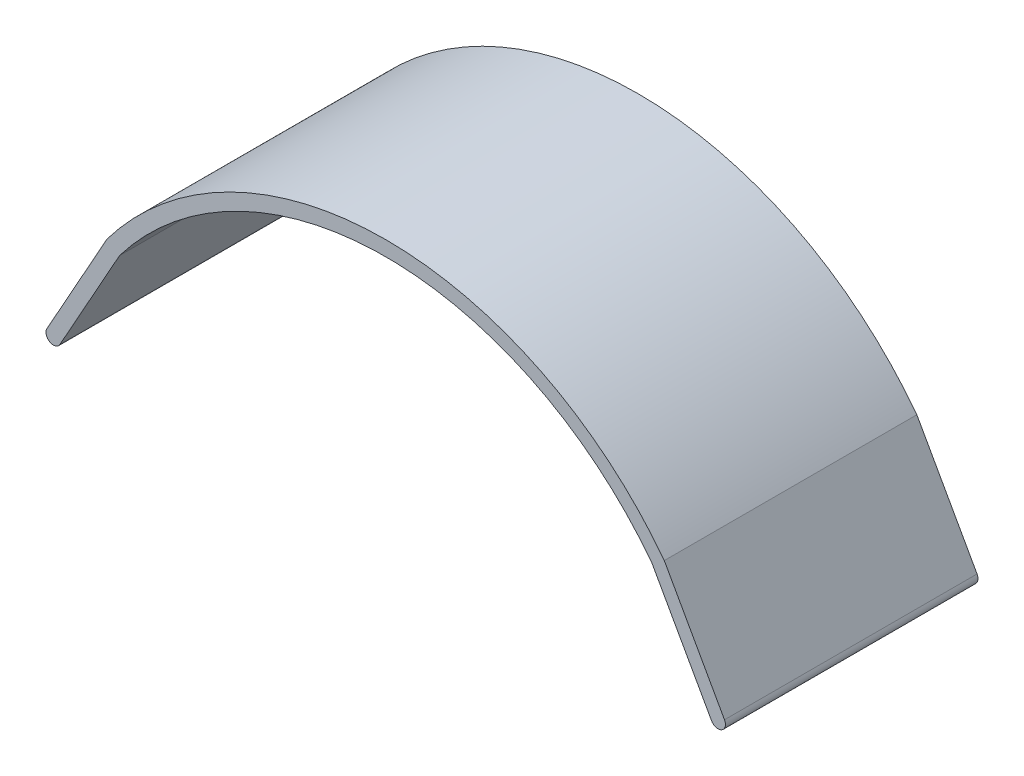
from build123d import *

# Parameters (mm, degrees)
BOSS_EXTRUDE1_DEPTH      = 2
BOSS_EXTRUDE1_DEPTH_BACK = 32


with BuildPart() as part:
    # Sketch2 → Boss-Extrude1 (new, two sides: drawn at the far end of the back side and taken through both)
    with BuildSketch(Plane.XY.offset(-BOSS_EXTRUDE1_DEPTH_BACK)):
        with BuildLine():
            Line((102.5, 31.332843133), (110.605952255, 16.81955568))
            ThreePointArc((110.605952255, 16.81955568), (110.22051471, 15.458880149), (108.859839179, 15.844317694))
            Line((108.859839179, 15.844317694), (100.821862298, 30.235898765))
            ThreePointArc((100.821862298, 30.235898765), (65, 48), (29.178137702, 30.235898765))
            Line((29.178137702, 30.235898765), (21.140160821, 15.844317694))
            ThreePointArc((21.140160821, 15.844317694), (19.77948529, 15.458880149), (19.394047745, 16.81955568))
            Line((19.394047745, 16.81955568), (27.5, 31.332843133))
            ThreePointArc((27.5, 31.332843133), (65, 50), (102.5, 31.332843133))
        make_face()
    extrude(amount=BOSS_EXTRUDE1_DEPTH + BOSS_EXTRUDE1_DEPTH_BACK)


solid = part.part
